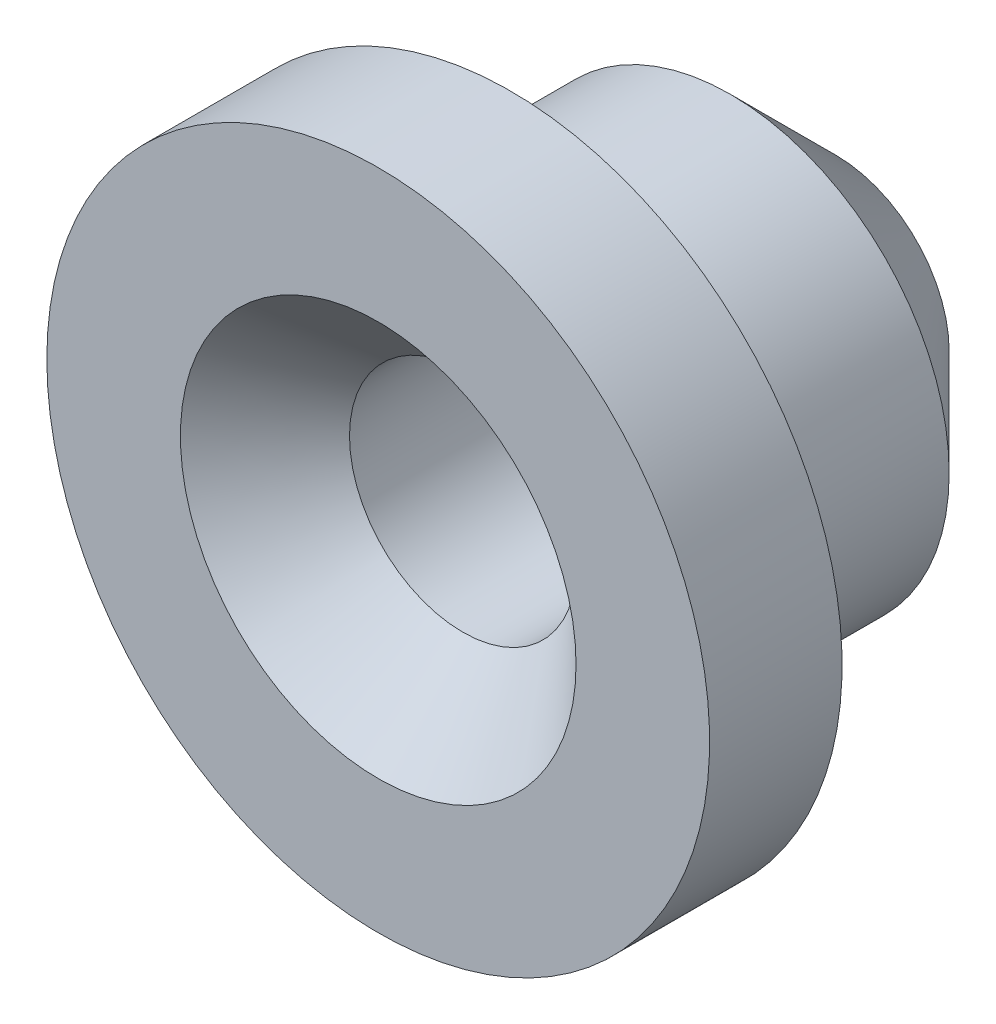
from build123d import *

# Parameters (mm, degrees)
SKETCH1_R                         = 4.9276
BOSS_EXTRUDE1_DEPTH               = 7.9375
SKETCH4_R                         = 4.9276
BOSS_EXTRUDE2_DEPTH               = 3.175
BOSS_EXTRUDE2_TAPER               = 45
F_1_4_20_TAPPED_HOLE1_D           = 5.1054
F_1_4_20_TAPPED_HOLE1_DEPTH       = 16.51
F_1_4_20_TAPPED_HOLE1_CSINK_D     = 8.9154
F_1_4_20_TAPPED_HOLE1_CSINK_ANGLE = 90
F_1_4_20_TAPPED_HOLE1_TIP         = 1.533816902
SKETCH5_W                         = 2.54
SKETCH5_H                         = 2.9845


with BuildPart() as part:
    # Sketch1 → Boss-Extrude1 (new body)
    with BuildSketch(Plane.XY):
        with Locations((-11.193990041, 3.085910768)):
            Circle(SKETCH1_R)
    extrude(amount=BOSS_EXTRUDE1_DEPTH)

    # Sketch4 → Boss-Extrude2 (add)
    with BuildSketch(Plane(origin=(0, 0, 0), x_dir=(-1, 0, 0), z_dir=(0, 0, -1))):
        with Locations((11.193990041, 3.085910768)):
            Circle(SKETCH4_R)
    extrude(amount=BOSS_EXTRUDE2_DEPTH, taper=BOSS_EXTRUDE2_TAPER)

    # 1/4-20 Tapped Hole1
    with Locations(Plane.XY.offset(7.9375)):
        with Locations((-11.193990041, 3.085910768)):
            CounterSinkHole(F_1_4_20_TAPPED_HOLE1_D / 2, F_1_4_20_TAPPED_HOLE1_CSINK_D / 2, depth=F_1_4_20_TAPPED_HOLE1_DEPTH, counter_sink_angle=F_1_4_20_TAPPED_HOLE1_CSINK_ANGLE)
            with Locations((0, 0, -(F_1_4_20_TAPPED_HOLE1_DEPTH + F_1_4_20_TAPPED_HOLE1_TIP / 2))):  # 118° drill point
                Cone(0, F_1_4_20_TAPPED_HOLE1_D / 2, F_1_4_20_TAPPED_HOLE1_TIP, mode=Mode.SUBTRACT)

    # Sketch5 → Revolve1 (revolve)
    with BuildSketch(Plane(origin=(0, 3.085910768, 0), x_dir=(1, 0, 0), z_dir=(0, 1, 0))):
        with Locations((-17.391590041, -6.44525)):
            Rectangle(SKETCH5_W, SKETCH5_H)
    revolve(axis=Axis((-11.193990041, 3.085910768, -2.3749), (0, 0, 1)))


solid = part.part
